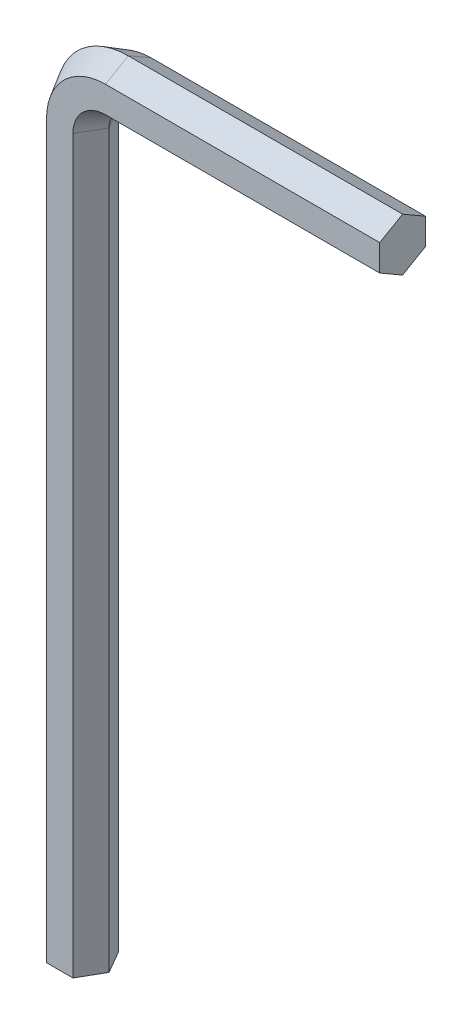
from build123d import *

# Parameters (mm, degrees)
BOSS_EXTRUDE1_DEPTH = 19.05
REVOLVE4_ANGLE      = 90
BOSS_EXTRUDE2_DEPTH = 50.8


with BuildPart() as part:
    # Sketch1 → Boss-Extrude1 (new body)
    with BuildSketch(Plane(origin=(0, 0, 0), x_dir=(0, 0, -1), z_dir=(1, 0, 0))):
        Polygon((1.5875, 0.916543552), (0, 1.833087105), (-1.5875, 0.916543552), (-1.5875, -0.916543552), (0, -1.833087105), (1.5875, -0.916543552), align=None)
    extrude(amount=-BOSS_EXTRUDE1_DEPTH)

    # Sketch3 → Revolve4 (revolve)
    with BuildSketch(Plane.ZY.offset(19.05)):
        Polygon((-1.5875, 0.916543552), (-1.5875, -0.916543552), (0, -1.833087105), (1.5875, -0.916543552), (1.5875, 0.916543552), (0, 1.833087105), align=None)
    revolve(axis=Axis((-19.05, -3.175, 0), (0, 0, 1)), revolution_arc=REVOLVE4_ANGLE)

    # Sketch4 → Boss-Extrude2 (add)
    with BuildSketch(Plane.XZ.offset(3.175)):
        Polygon((-24.058087105, 0), (-23.141543552, -1.5875), (-21.308456448, -1.5875), (-20.391912895, 0), (-21.308456448, 1.5875), (-23.141543552, 1.5875), align=None)
    extrude(amount=BOSS_EXTRUDE2_DEPTH)


solid = part.part
